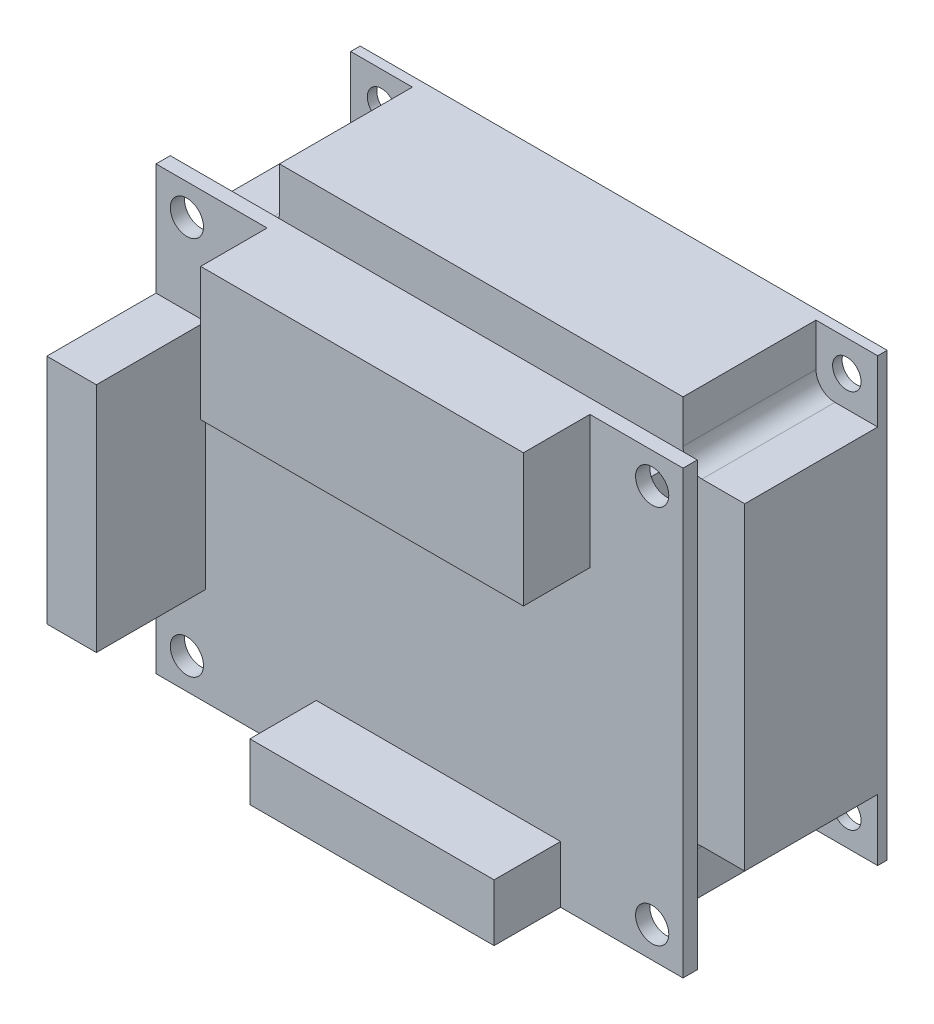
from build123d import *

# Parameters (mm, degrees)
SKETCH_1_W          = 55.5
SKETCH_1_H          = 46.5
EXTRUDE_1_DEPTH     = 15
SKETCH_2_W          = 6.5
SKETCH_2_H          = 6.5
CUT_EXTRUDE_1_DEPTH = 14
FILLET_1_R          = 2
SKETCH_3_W          = 4
SKETCH_3_H          = 34
EXTRUDE_2_DEPTH     = 5
SKETCH_4_W          = 55.5
SKETCH_4_H          = 46.5
EXTRUDE_3_DEPTH     = 1.5
SKETCH_5_R          = 1.5
CUT_EXTRUDE_2_DEPTH = 1
SKETCH_6_R          = 1.75
CUT_EXTRUDE_3_DEPTH = 2
SKETCH_7_W          = 33.995169083
SKETCH_7_H          = 13.97859025
SKETCH_7_W_2        = 5.219477383
SKETCH_7_H_2        = 24.424681599
SKETCH_7_W_3        = 25.720685112
SKETCH_7_H_3        = 6.003184014
EXTRUDE_4_DEPTH     = 10
SKETCH_8_W          = 33.995169083
SKETCH_8_H          = 13.97859025
SKETCH_8_W_2        = 25.720685112
SKETCH_8_H_2        = 6.003184014
CUT_EXTRUDE_4_DEPTH = 3
SKETCH_10_W         = 5.219477383
SKETCH_10_H         = 24.424681599
EXTRUDE_6_DEPTH     = 1.5


with BuildPart() as part:
    # 草图1 → 凸台-拉伸1 (new body)
    with BuildSketch(Plane.XY):
        Rectangle(SKETCH_1_W, SKETCH_1_H)
    extrude(amount=EXTRUDE_1_DEPTH)

    # 草图2 → 切除-拉伸1 (cut)
    with BuildSketch(Plane.XY.offset(15)):
        with Locations((-24.5, 20)):
            Rectangle(SKETCH_2_W, SKETCH_2_H)
        with Locations((24.5, 20)):
            Rectangle(SKETCH_2_W, SKETCH_2_H)
        with Locations((24.5, -20)):
            Rectangle(SKETCH_2_W, SKETCH_2_H)
        with Locations((-24.5, -20)):
            Rectangle(SKETCH_2_W, SKETCH_2_H)
    extrude(amount=-CUT_EXTRUDE_1_DEPTH, mode=Mode.SUBTRACT)

    # 圆角1
    fillet_1_edges = [part.edges().sort_by_distance(p)[0] for p in [
        (-21.25, 16.75, 8),
        (21.25, 16.75, 8),
        (21.25, -16.75, 8),
        (-21.25, -16.75, 8),
    ]]
    fillet(fillet_1_edges, radius=FILLET_1_R)

    # 草图3 → 凸台-拉伸2 (add)
    with BuildSketch(Plane.XY.offset(15)):
        with Locations((-18.75, 0.147123408)):
            Rectangle(SKETCH_3_W, SKETCH_3_H)
        with Locations((18.75, 0.147123408)):
            Rectangle(SKETCH_3_W, SKETCH_3_H)
    extrude(amount=EXTRUDE_2_DEPTH)

    # 草图4 → 凸台-拉伸3 (add)
    with BuildSketch(Plane.XY.offset(20)):
        Rectangle(SKETCH_4_W, SKETCH_4_H)
    extrude(amount=EXTRUDE_3_DEPTH)

    # 草图5 → 切除-拉伸2 (cut)
    with BuildSketch(Plane.XY.offset(1)):
        with Locations((24.5, 20)):
            Circle(SKETCH_5_R)
        with Locations((-24.5, 20)):
            Circle(SKETCH_5_R)
        with Locations((-24.5, -20)):
            Circle(SKETCH_5_R)
        with Locations((24.5, -20)):
            Circle(SKETCH_5_R)
    extrude(amount=-CUT_EXTRUDE_2_DEPTH, mode=Mode.SUBTRACT)

    # 草图6 → 切除-拉伸3 (cut)
    with BuildSketch(Plane.XY.offset(21.5)):
        with Locations((-24.5, 20)):
            Circle(SKETCH_6_R)
        with Locations((24.5, 20)):
            Circle(SKETCH_6_R)
        with Locations((24.5, -20)):
            Circle(SKETCH_6_R)
        with Locations((-24.5, -20)):
            Circle(SKETCH_6_R)
    extrude(amount=-CUT_EXTRUDE_3_DEPTH, mode=Mode.SUBTRACT)

    # 草图7 → 凸台-拉伸4 (add)
    with BuildSketch(Plane.XY.offset(21.5)):
        with Locations((0.947079491, 16.260704875)):
            Rectangle(SKETCH_7_W, SKETCH_7_H)
        with Locations((-25.140261309, -0.747694334)):
            Rectangle(SKETCH_7_W_2, SKETCH_7_H_2)
        with Locations((1.993851559, -20.248407993)):
            Rectangle(SKETCH_7_W_3, SKETCH_7_H_3)
    extrude(amount=EXTRUDE_4_DEPTH)

    # 草图8 → 切除-拉伸4 (cut)
    with BuildSketch(Plane.XY.offset(31.5)):
        with Locations((0.947079491, 16.260704875)):
            Rectangle(SKETCH_8_W, SKETCH_8_H)
        with Locations((1.993851559, -20.248407993)):
            Rectangle(SKETCH_8_W_2, SKETCH_8_H_2)
    extrude(amount=-CUT_EXTRUDE_4_DEPTH, mode=Mode.SUBTRACT)

    # 草图10 → 凸台-拉伸6 (add)
    with BuildSketch(Plane.XY.offset(31.5)):
        with Locations((-25.140261309, -0.747694334)):
            Rectangle(SKETCH_10_W, SKETCH_10_H)
    extrude(amount=EXTRUDE_6_DEPTH)


solid = part.part
